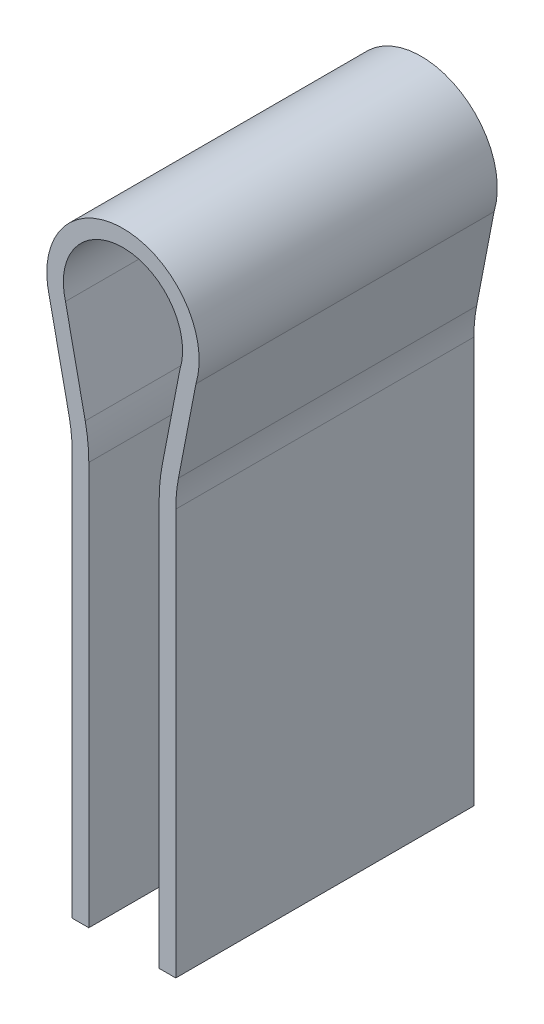
from build123d import *

# Parameters (mm, degrees)
DODANIE_WYCI_GNI_CIE1_DEPTH = 18


with BuildPart() as part:
    # Szkic2 → Dodanie-wyciągnięcie1 (new body)
    with BuildSketch(Plane.XY):
        with BuildLine():
            Line((0, 0), (0, 24.330191411))
            ThreePointArc((0, 24.330191411), (-0.054041749, 25.36841801), (-0.215582894, 26.395423093))
            Line((-0.215582894, 26.395423093), (-1.407305533, 32.041429535))
            ThreePointArc((-1.407305533, 32.041429535), (2.127962125, 36.599291484), (5.495841527, 31.916385196))
            Line((5.495841527, 31.916385196), (4.431589852, 26.408240777))
            ThreePointArc((4.431589852, 26.408240777), (4.29550098, 25.464048307), (4.25, 24.511184591))
            Line((4.25, 24.511184591), (4.25, 0))
            Line((4.25, 0), (5.25, 0))
            Line((5.25, 0), (5.25, 24.511184591))
            ThreePointArc((5.25, 24.511184591), (5.290950882, 25.368761936), (5.413430867, 26.218535158))
            Line((5.413430867, 26.218535158), (6.467446251, 31.6737006))
            ThreePointArc((6.467446251, 31.6737006), (2.131889217, 37.599362518), (-2.379787023, 31.806668719))
            Line((-2.379787023, 31.806668719), (-1.194024605, 26.188899925))
            ThreePointArc((-1.194024605, 26.188899925), (-1.048637574, 25.26459535), (-1, 24.330191411))
            Line((-1, 24.330191411), (-1, 0))
            Line((-1, 0), (0, 0))
        make_face()
    extrude(amount=DODANIE_WYCI_GNI_CIE1_DEPTH)


solid = part.part
